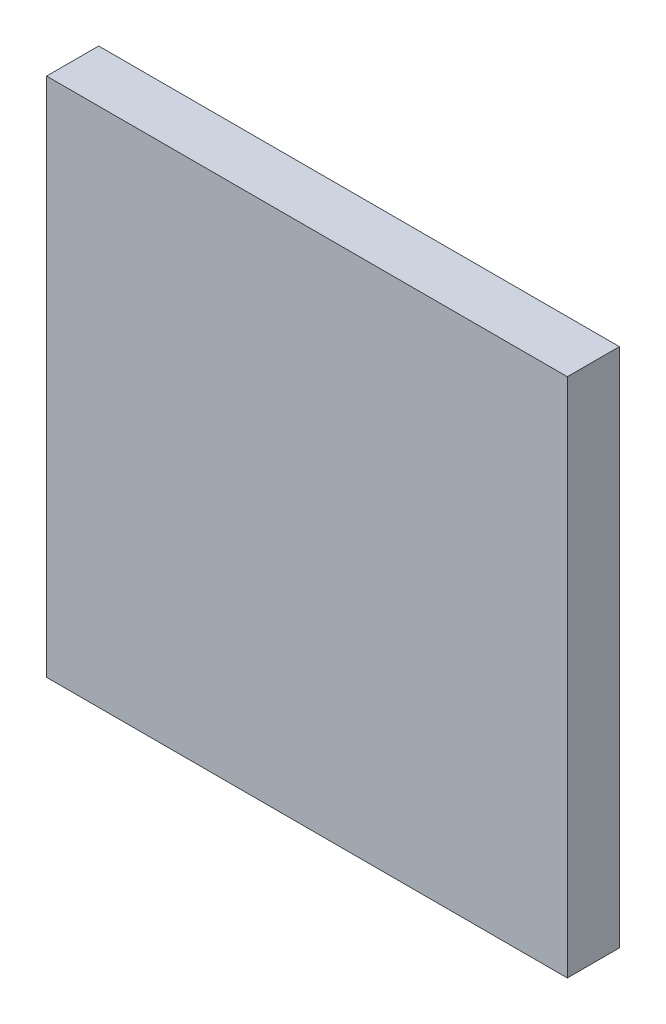
from build123d import *

# Parameters (mm, degrees)
SKETCH1_W           = 1000
SKETCH1_H           = 1000
BOSS_EXTRUDE1_DEPTH = 100


with BuildPart() as part:
    # Sketch1 → Boss-Extrude1 (new body)
    with BuildSketch(Plane.XY):
        with Locations((500, 500)):
            Rectangle(SKETCH1_W, SKETCH1_H)
    extrude(amount=BOSS_EXTRUDE1_DEPTH)


solid = part.part
